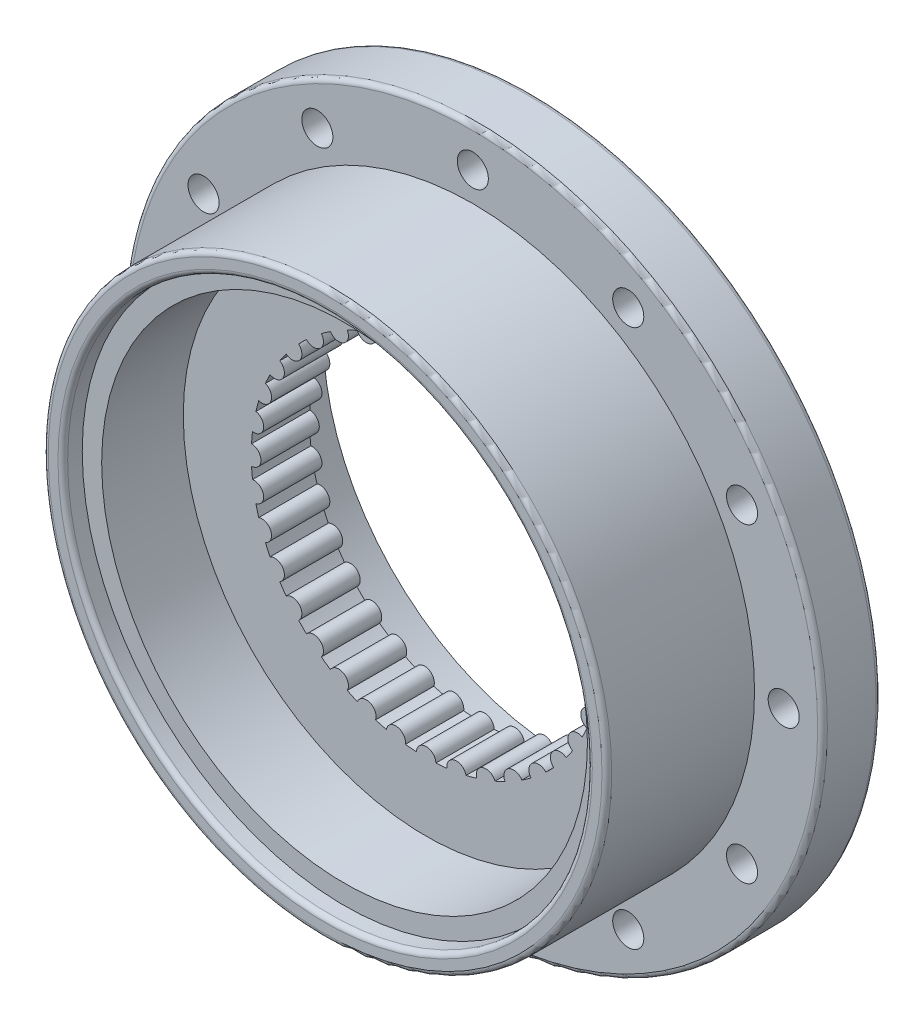
from build123d import *

# Parameters (mm, degrees)
ENL_V_MAT_EXTRU_1_DEPTH      = 266.661438677
ENL_V_MAT_EXTRU_1_DEPTH_BACK = 266.661438677
ESQUISSE2_R                  = 8
ESQUISSE5_R                  = 5
BOSS_EXTRU_1_DEPTH           = 30
CONG_1_R                     = 2.5


with BuildPart() as part:
    # Esquisse1 → Révolution1 (revolve)
    with BuildSketch(Plane(origin=(0, 0, 0), x_dir=(0, 0, -1), z_dir=(1, 0, 0)), mode=Mode.PRIVATE) as r_volution1_sk:
        Polygon((0, 125), (0, 145), (-18, 145), (-18, 180), (-48, 180), (-48, 145), (-124, 145), (-124, 135), (-114, 135), (-114, 125), (-72, 125), (-72, 90), (-42, 90), (-42, 125), align=None)
    revolve(r_volution1_sk.sketch.rotate(Axis((0, 0, 0), (0, 0, 1)), 90), axis=Axis((0, 0, 0), (0, 0, 1)))

    # Esquisse2 → Enlèv. mat.-Extru.1 (cut, two sides: drawn at the far end of the back side and taken through both)
    with BuildSketch(Plane.XY.offset(48).offset(-ENL_V_MAT_EXTRU_1_DEPTH_BACK)):
        with Locations((0, 160)):
            Circle(ESQUISSE2_R)
        with Locations((80, 138.564064606)):
            Circle(ESQUISSE2_R)
        with Locations((138.564064606, 80)):
            Circle(ESQUISSE2_R)
        with Locations((160, 0)):
            Circle(ESQUISSE2_R)
        with Locations((138.564064606, -80)):
            Circle(ESQUISSE2_R)
        with Locations((80, -138.564064606)):
            Circle(ESQUISSE2_R)
        with Locations((0, -160)):
            Circle(ESQUISSE2_R)
        with Locations((-80, -138.564064606)):
            Circle(ESQUISSE2_R)
        with Locations((-138.564064605, -80)):
            Circle(ESQUISSE2_R)
        with Locations((-160, 0)):
            Circle(ESQUISSE2_R)
        with Locations((-138.564064606, 80)):
            Circle(ESQUISSE2_R)
        with Locations((-80, 138.564064606)):
            Circle(ESQUISSE2_R)
    extrude(amount=ENL_V_MAT_EXTRU_1_DEPTH + ENL_V_MAT_EXTRU_1_DEPTH_BACK, mode=Mode.SUBTRACT)

    # Esquisse5 → Boss.-Extru.1 (add)
    with BuildSketch(Plane(origin=(0, 0, 42), x_dir=(-1, 0, 0), z_dir=(0, 0, -1))):
        with Locations((0, 90)):
            Circle(ESQUISSE5_R)
        with Locations((15.62833599, 88.632697771)):
            Circle(ESQUISSE5_R)
        with Locations((30.781812899, 84.572335871)):
            Circle(ESQUISSE5_R)
        with Locations((45, 77.942286341)):
            Circle(ESQUISSE5_R)
        with Locations((57.850884872, 68.943999881)):
            Circle(ESQUISSE5_R)
        with Locations((68.943999881, 57.850884872)):
            Circle(ESQUISSE5_R)
        with Locations((77.942286341, 45)):
            Circle(ESQUISSE5_R)
        with Locations((84.572335871, 30.781812899)):
            Circle(ESQUISSE5_R)
        with Locations((88.632697771, 15.62833599)):
            Circle(ESQUISSE5_R)
        with Locations((90, 0)):
            Circle(ESQUISSE5_R)
        with Locations((88.632697771, -15.62833599)):
            Circle(ESQUISSE5_R)
        with Locations((84.572335871, -30.781812899)):
            Circle(ESQUISSE5_R)
        with Locations((77.942286341, -45)):
            Circle(ESQUISSE5_R)
        with Locations((68.943999881, -57.850884872)):
            Circle(ESQUISSE5_R)
        with Locations((57.850884872, -68.943999881)):
            Circle(ESQUISSE5_R)
        with Locations((45, -77.942286341)):
            Circle(ESQUISSE5_R)
        with Locations((30.781812899, -84.572335871)):
            Circle(ESQUISSE5_R)
        with Locations((15.62833599, -88.632697771)):
            Circle(ESQUISSE5_R)
        with Locations((0, -90)):
            Circle(ESQUISSE5_R)
        with Locations((-15.62833599, -88.632697771)):
            Circle(ESQUISSE5_R)
        with Locations((-30.781812899, -84.572335871)):
            Circle(ESQUISSE5_R)
        with Locations((-45, -77.942286341)):
            Circle(ESQUISSE5_R)
        with Locations((-57.850884872, -68.943999881)):
            Circle(ESQUISSE5_R)
        with Locations((-68.943999881, -57.850884872)):
            Circle(ESQUISSE5_R)
        with Locations((-77.942286341, -45)):
            Circle(ESQUISSE5_R)
        with Locations((-84.572335871, -30.781812899)):
            Circle(ESQUISSE5_R)
        with Locations((-88.632697771, -15.62833599)):
            Circle(ESQUISSE5_R)
        with Locations((-90, 0)):
            Circle(ESQUISSE5_R)
        with Locations((-88.632697771, 15.62833599)):
            Circle(ESQUISSE5_R)
        with Locations((-84.572335871, 30.781812899)):
            Circle(ESQUISSE5_R)
        with Locations((-77.942286341, 45)):
            Circle(ESQUISSE5_R)
        with Locations((-68.943999881, 57.850884872)):
            Circle(ESQUISSE5_R)
        with Locations((-57.850884872, 68.943999881)):
            Circle(ESQUISSE5_R)
        with Locations((-45, 77.942286341)):
            Circle(ESQUISSE5_R)
        with Locations((-30.781812899, 84.572335871)):
            Circle(ESQUISSE5_R)
        with Locations((-15.62833599, 88.632697771)):
            Circle(ESQUISSE5_R)
    extrude(amount=-BOSS_EXTRU_1_DEPTH)

    # Congé1
    cong_1_edges = [part.edges().sort_by_distance(p)[0] for p in [
        (135, 0, 124),
        (145, 0, 124),
        (180, 0, 48),
        (180, 0, 18),
        (145, 0, 0),
    ]]
    fillet(cong_1_edges, radius=CONG_1_R)


solid = part.part
